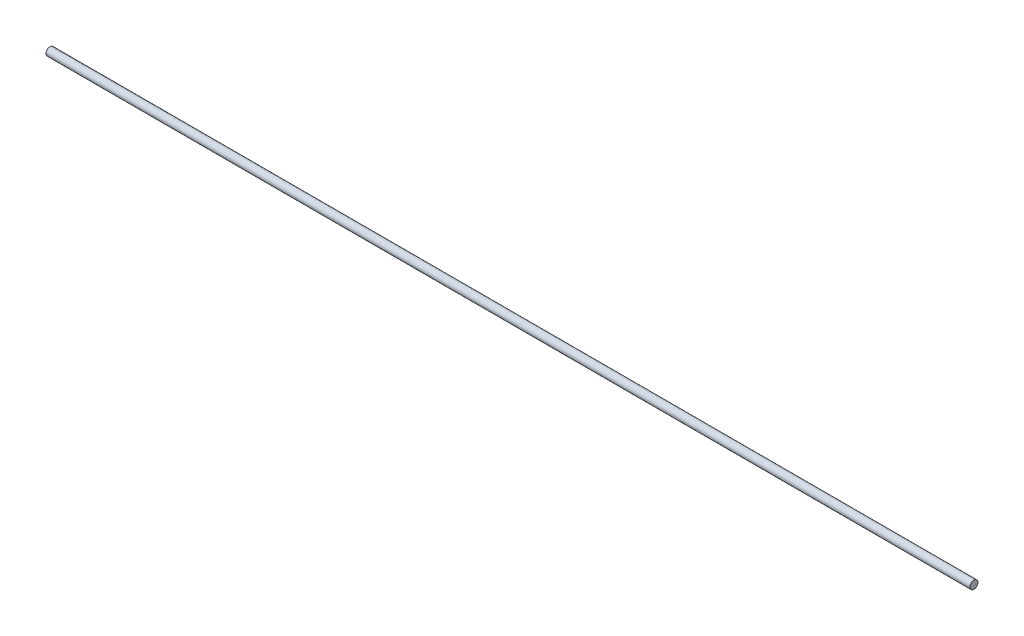
from build123d import *

# Parameters (mm, degrees)
SKETCH1_R           = 3.96875
BOSS_EXTRUDE1_DEPTH = 914.4


with BuildPart() as part:
    # Sketch1 → Boss-Extrude1 (new body)
    with BuildSketch(Plane(origin=(0, 0, 0), x_dir=(0, 0, -1), z_dir=(1, 0, 0))):
        with Locations(Location((0, 0, 0), (0, 0, 180))):
            Circle(SKETCH1_R)
    extrude(amount=BOSS_EXTRUDE1_DEPTH)


solid = part.part
